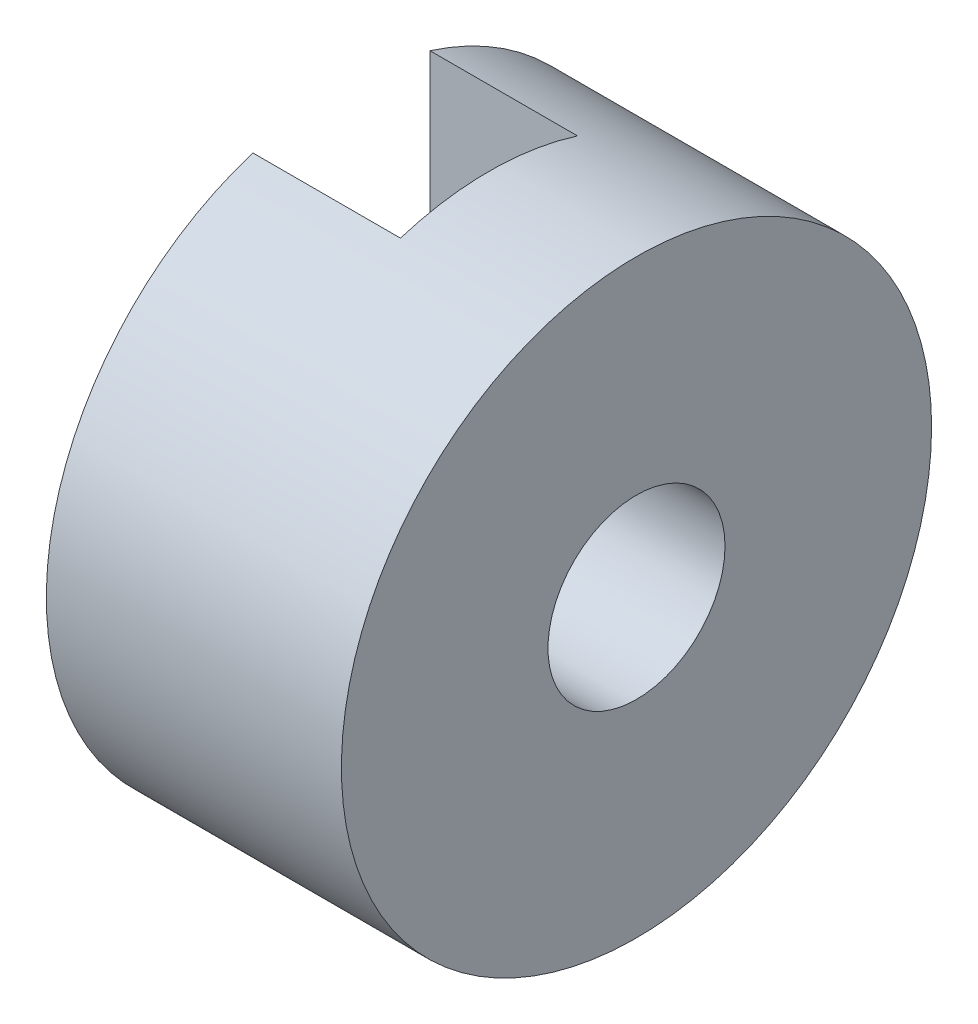
from build123d import *

# Parameters (mm, degrees)
SKETCH_1_R          = 10
SKETCH_1_R_2        = 3
EXTRUDE_1_DEPTH     = 10
CUT_EXTRUDE_1_DEPTH = 5


with BuildPart() as part:
    # ｽｹｯﾁ1 → ﾎﾞｽ - 押し出し1 (new body)
    with BuildSketch(Plane(origin=(0, 0, 0), x_dir=(0, 0, -1), z_dir=(1, 0, 0))):
        Circle(SKETCH_1_R)
        Circle(SKETCH_1_R_2, mode=Mode.SUBTRACT)
    extrude(amount=EXTRUDE_1_DEPTH)

    # ｽｹｯﾁ2 → ｶｯﾄ - 押し出し1 (cut)
    with BuildSketch(Plane.ZY):
        with BuildLine():
            Line((3, 10), (3, 0))
            ThreePointArc((3, 0), (0, -3), (-3, 0))
            Line((-3, 0), (-3, 10))
            ThreePointArc((-3, 10), (0, 13), (3, 10))
        make_face()
    extrude(amount=-CUT_EXTRUDE_1_DEPTH, mode=Mode.SUBTRACT)


solid = part.part
